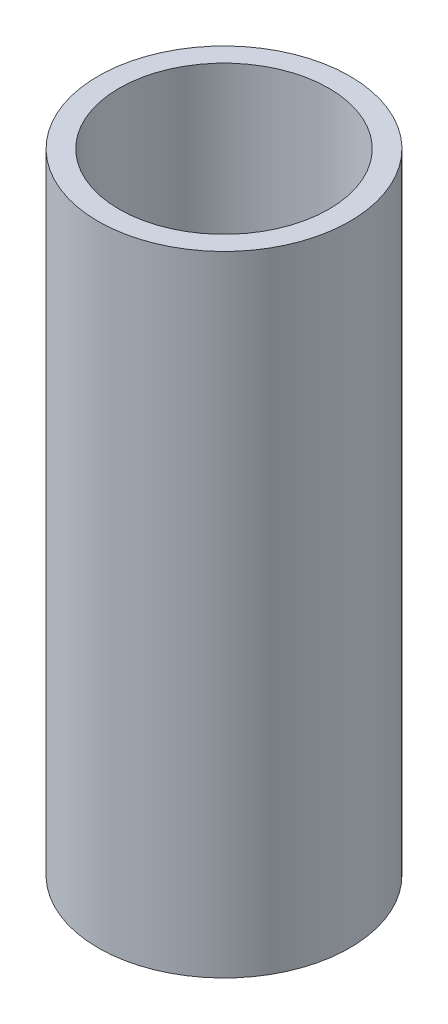
from build123d import *

# Parameters (mm, degrees)
SKETCH1_R           = 12
SKETCH1_R_2         = 10
BOSS_EXTRUDE1_DEPTH = 60


with BuildPart() as part:
    # Sketch1 → Boss-Extrude1 (new body)
    with BuildSketch(Plane(origin=(0, 0, 0), x_dir=(1, 0, 0), z_dir=(0, 1, 0))):
        with Locations(Location((0, 0, 0), (0, 0, 270))):
            Circle(SKETCH1_R)
        with Locations(Location((0, 0, 0), (0, 0, 270))):
            Circle(SKETCH1_R_2, mode=Mode.SUBTRACT)
    extrude(amount=BOSS_EXTRUDE1_DEPTH)


solid = part.part
